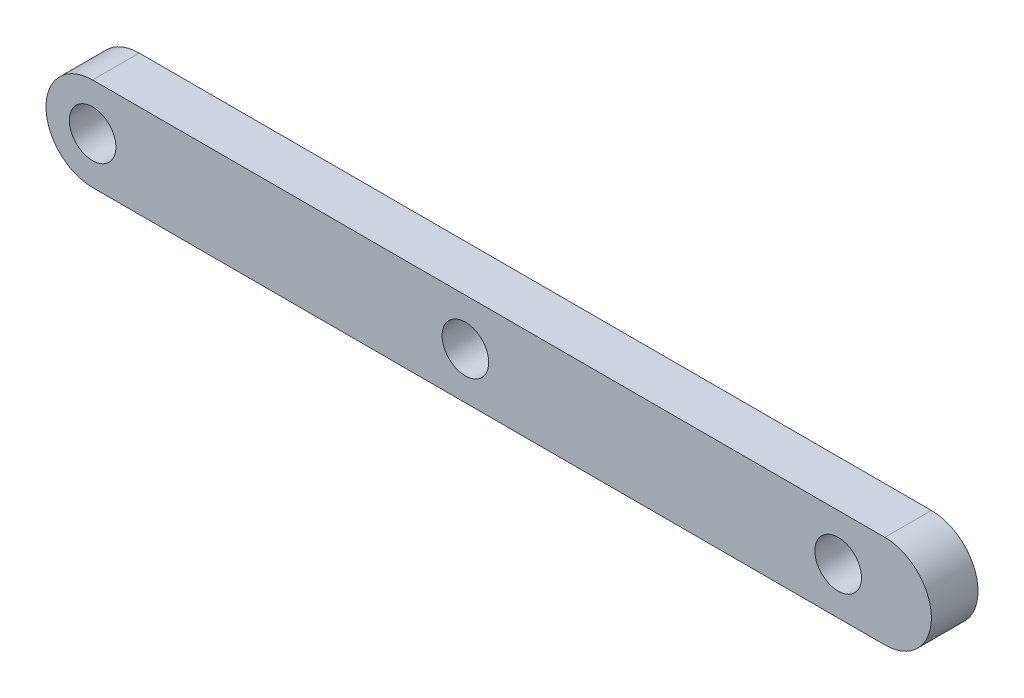
from build123d import *

# Parameters (mm, degrees)
SALIENTE_EXTRUIR1_DEPTH = 2
CROQUIS2_R              = 1
CORTAR_EXTRUIR1_DEPTH   = 2


with BuildPart() as part:
    # Croquis1 → Saliente-Extruir1 (new body)
    with BuildSketch(Plane.XY):
        with BuildLine():
            Line((0, 2), (34, 2))
            ThreePointArc((34, 2), (36, 0), (34, -2))
            Line((34, -2), (0, -2))
            ThreePointArc((0, -2), (-2, 0), (0, 2))
        make_face()
    extrude(amount=SALIENTE_EXTRUIR1_DEPTH)

    # Croquis2 → Cortar-Extruir1 (cut)
    with BuildSketch(Plane.XY.offset(2)):
        Circle(CROQUIS2_R)
        with Locations((16, 0)):
            Circle(CROQUIS2_R)
        with Locations((32, 0)):
            Circle(CROQUIS2_R)
    extrude(amount=-CORTAR_EXTRUIR1_DEPTH, mode=Mode.SUBTRACT)


solid = part.part
